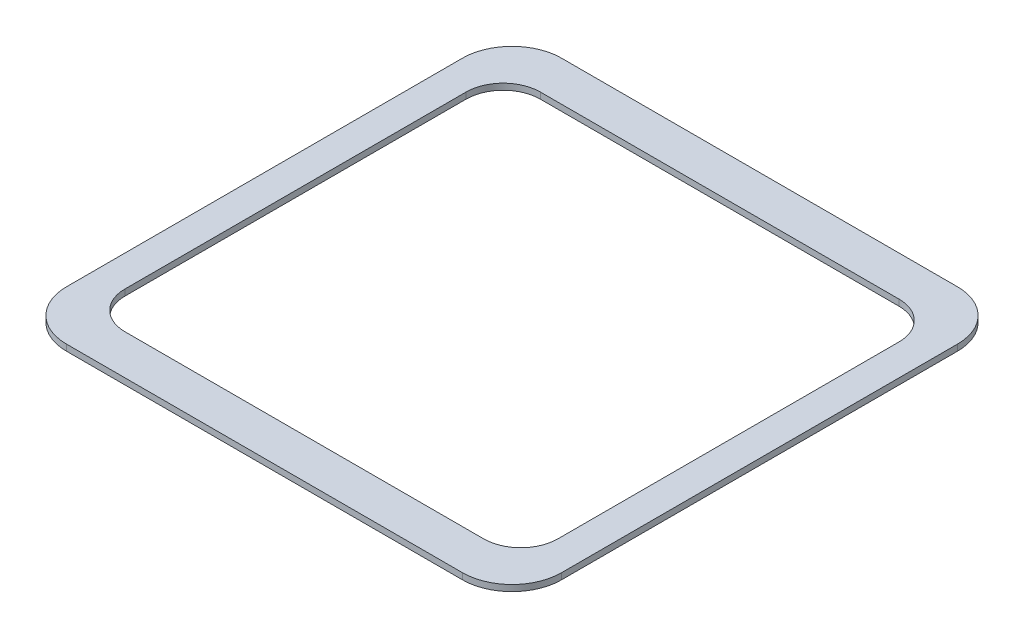
from build123d import *

# Parameters (mm, degrees)
MAINBODY_DEPTH = 1.5875


with BuildPart() as part:
    # Sketch2 → MainBody (new body)
    with BuildSketch(Plane(origin=(0, -3.4417, 0), x_dir=(-1, 0, 0), z_dir=(0, -1, 0))):
        with BuildLine():
            Line((-50.8, 63.5), (50.8, 63.5))
            ThreePointArc((50.8, 63.5), (59.780256121, 59.780256121), (63.5, 50.8))
            Line((63.5, 50.8), (63.5, -50.8))
            ThreePointArc((63.5, -50.8), (59.780256121, -59.780256121), (50.8, -63.5))
            Line((50.8, -63.5), (-50.8, -63.5))
            ThreePointArc((-50.8, -63.5), (-59.780256121, -59.780256121), (-63.5, -50.8))
            Line((-63.5, -50.8), (-63.5, 50.8))
            ThreePointArc((-63.5, 50.8), (-59.780256121, 59.780256121), (-50.8, 63.5))
        make_face()
        with BuildLine():
            Line((45.992219207, 53.26253), (-45.992219207, 53.26253))
            ThreePointArc((-45.992219207, 53.26253), (-52.726513272, 50.473094065), (-55.515949207, 43.7388))
            Line((-55.515949207, 43.7388), (-55.515949207, -43.7388))
            ThreePointArc((-55.515949207, -43.7388), (-52.726513272, -50.473094065), (-45.992219207, -53.26253))
            Line((-45.992219207, -53.26253), (45.992219207, -53.26253))
            ThreePointArc((45.992219207, -53.26253), (52.726513272, -50.473094065), (55.515949207, -43.7388))
            Line((55.515949207, -43.7388), (55.515949207, 0))
            Line((55.515949207, 0), (55.515949207, 43.7388))
            ThreePointArc((55.515949207, 43.7388), (52.726513272, 50.473094065), (45.992219207, 53.26253))
        make_face(mode=Mode.SUBTRACT)
    extrude(amount=MAINBODY_DEPTH)


solid = part.part
